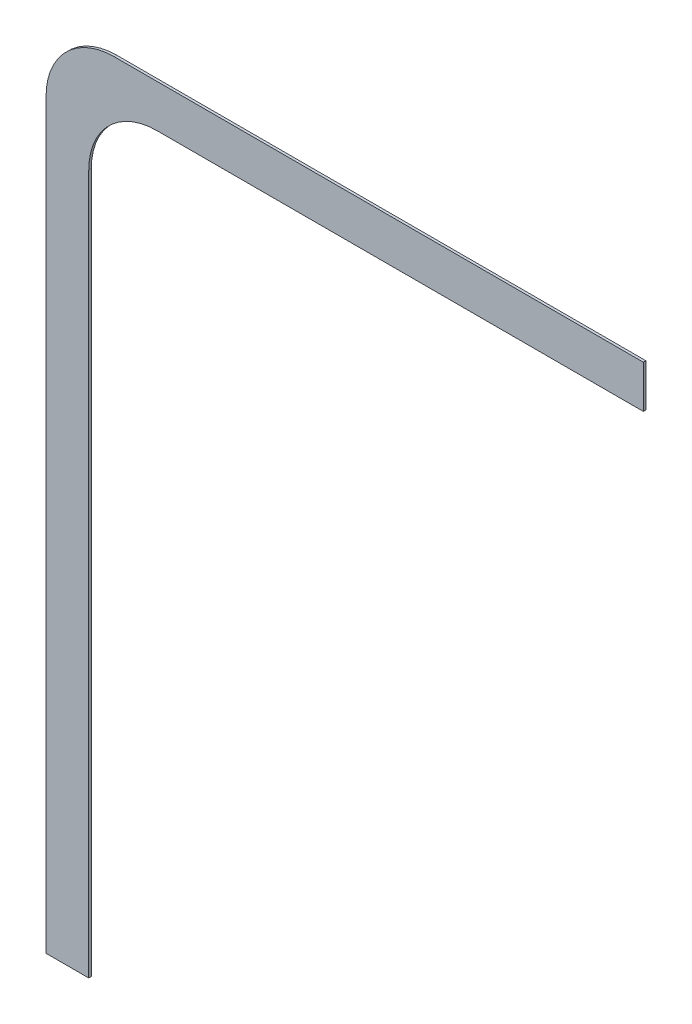
from build123d import *

# Parameters (mm, degrees)
BOSS_EXTRUDE1_DEPTH = 3


with BuildPart() as part:
    # Sketch1 → Boss-Extrude1 (new body)
    with BuildSketch(Plane.XY):
        with BuildLine():
            Line((0, 0), (0, 870))
            ThreePointArc((0, 870), (23.431457505, 926.568542495), (80, 950))
            Line((80, 950), (700, 950))
            Line((700, 950), (700, 900))
            Line((700, 900), (130, 900))
            ThreePointArc((130, 900), (73.431457505, 876.568542495), (50, 820))
            Line((50, 820), (50, 0))
            Line((50, 0), (0, 0))
        make_face()
    extrude(amount=BOSS_EXTRUDE1_DEPTH)


solid = part.part
